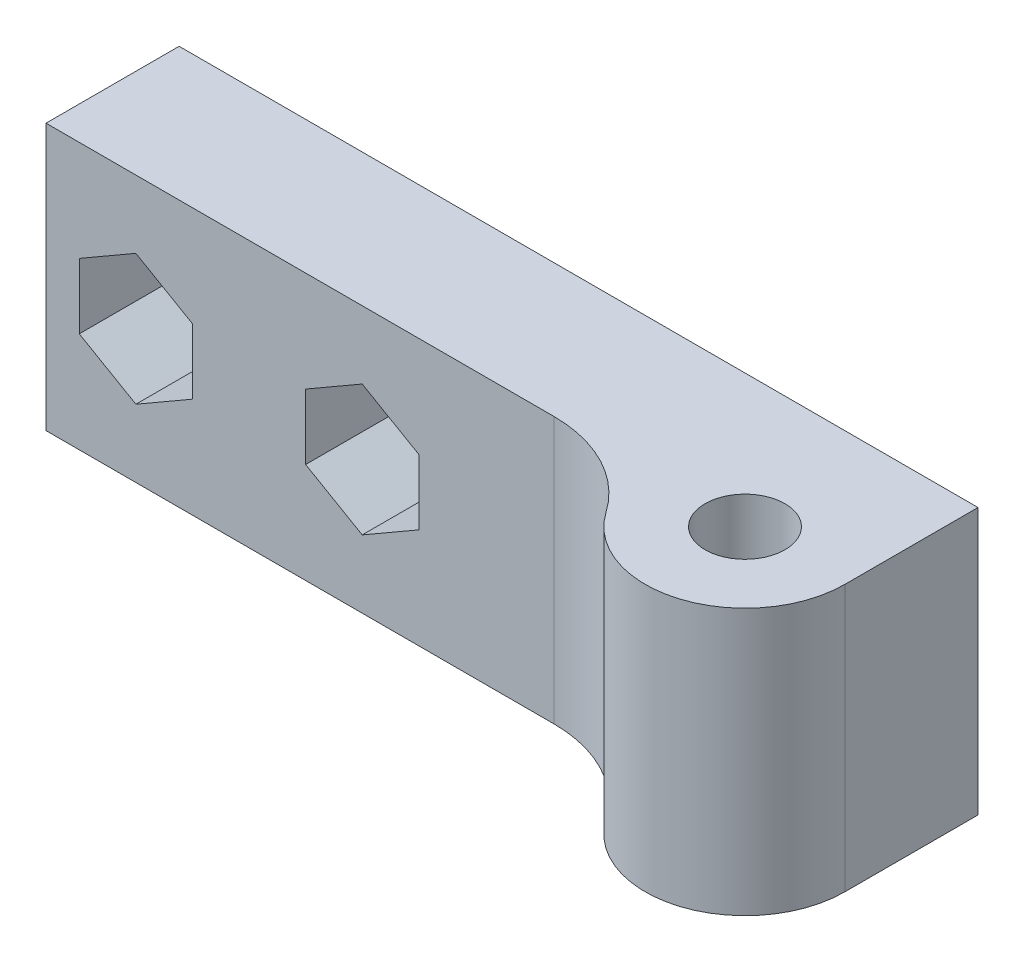
from build123d import *

# Parameters (mm, degrees)
SKETCH1_W           = 60
SKETCH1_H           = 20
BOSS_EXTRUDE1_DEPTH = 10
CUT_EXTRUDE1_DEPTH  = 7.5
SKETCH5_R           = 2.75
CUT_EXTRUDE3_DEPTH  = 37.827299657
LPATTERN1_COUNT     = 2
LPATTERN1_PITCH     = 17
SKETCH3_R           = 7.5
BOSS_EXTRUDE2_DEPTH = 20
SKETCH4_R           = 3
CUT_EXTRUDE2_DEPTH  = 41.078048855
FILLET1_R           = 10


with BuildPart() as part:
    # Sketch1 → Boss-Extrude1 (new body)
    with BuildSketch(Plane.XY):
        with Locations((0, -10)):
            Rectangle(SKETCH1_W, SKETCH1_H)
    extrude(amount=BOSS_EXTRUDE1_DEPTH)

    # Sketch2 → Cut-Extrude1 (cut)
    with BuildSketch(Plane.XY.offset(10)):
        Polygon((-23.25, -14.907477288), (-19, -12.453738644), (-19, -7.546261356), (-23.25, -5.092522712), (-27.5, -7.546261356), (-27.5, -12.453738644), align=None)
    cut_extrude1 = extrude(amount=-CUT_EXTRUDE1_DEPTH, mode=Mode.SUBTRACT)

    # Sketch5 → Cut-Extrude3 (cut, through all)
    with BuildSketch(Plane.XY.offset(2.5)):
        with Locations((-23.25, -10)):
            Circle(SKETCH5_R)
    cut_extrude3 = extrude(amount=-CUT_EXTRUDE3_DEPTH, mode=Mode.SUBTRACT)

    # LPattern1: Cut-Extrude1, Cut-Extrude3 ×2
    with Locations(*[(i * LPATTERN1_PITCH, 0, 0) for i in range(1, LPATTERN1_COUNT)]):
        add(cut_extrude1, mode=Mode.SUBTRACT)
        add(cut_extrude3, mode=Mode.SUBTRACT)

    # Sketch3 → Boss-Extrude2 (add, through all)
    with BuildSketch(Plane(origin=(0, 0, 0), x_dir=(1, 0, 0), z_dir=(0, 1, 0))):
        with Locations((22.5, -10)):
            Circle(SKETCH3_R)
    extrude(amount=-BOSS_EXTRUDE2_DEPTH)

    # Sketch4 → Cut-Extrude2 (cut, through all)
    with BuildSketch(Plane(origin=(0, 0, 0), x_dir=(1, 0, 0), z_dir=(0, 1, 0))):
        with Locations(Location((22.5, -10, 0), (0, 0, 180))):
            Circle(SKETCH4_R)
    extrude(amount=-CUT_EXTRUDE2_DEPTH, mode=Mode.SUBTRACT)

    # Fillet1
    fillet1_edges = [part.edges().sort_by_distance(p)[0] for p in [
        (15, -10, 10),
    ]]
    fillet(fillet1_edges, radius=FILLET1_R)


solid = part.part
